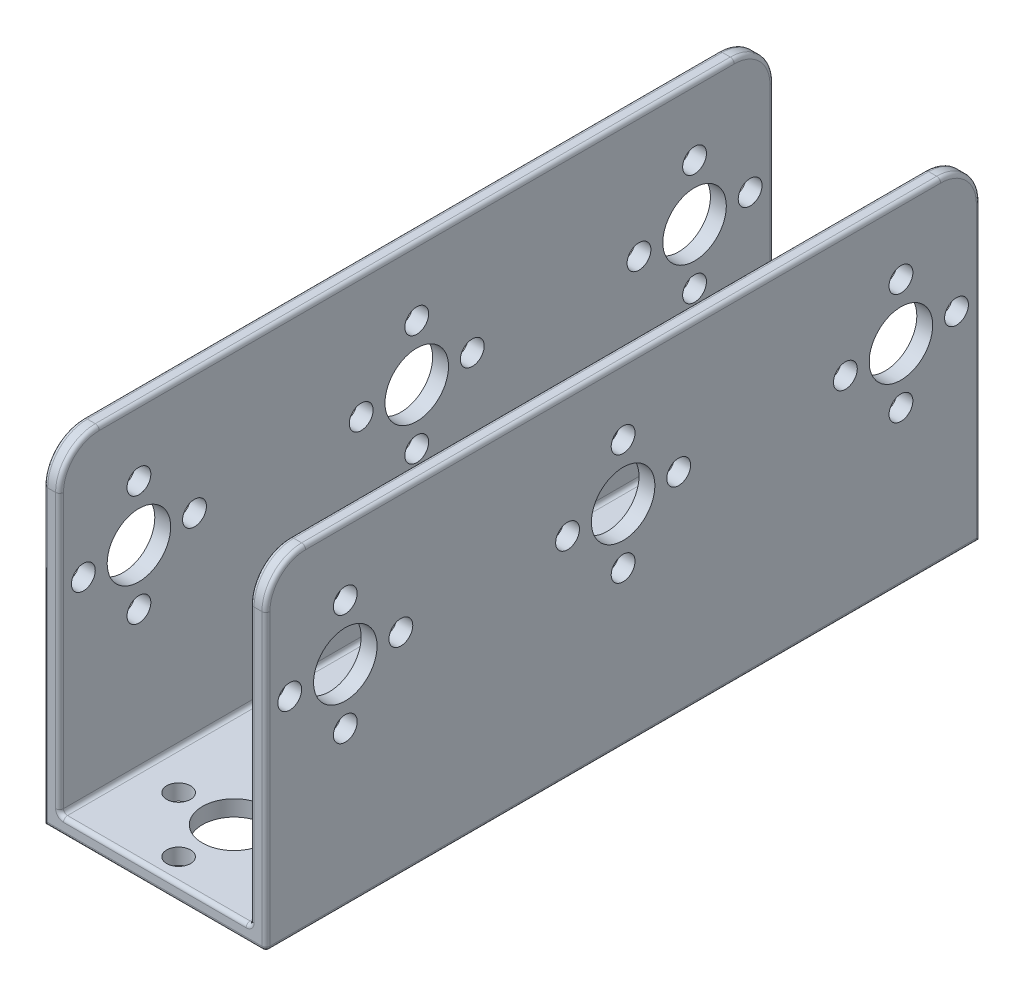
from build123d import *

# Parameters (mm, degrees)
SKETCH1_W                 = 28
SKETCH1_H                 = 90
BOSS_EXTRUDE1_DEPTH       = 2
SKETCH2_W                 = 2
SKETCH2_H                 = 90
BOSS_EXTRUDE2_DEPTH       = 40
FILLET2_R                 = 5
FILLET3_R                 = 0.5
F_8_0MM_DOWEL_HOLE1_D     = 8
F_3_0MM_DOWEL_HOLE2_D     = 3
F_8_0MM_DOWEL_HOLE2_D     = 8
F_8_0MM_DOWEL_HOLE2_DEPTH = 3
F_8_0MM_DOWEL_HOLE2_TIP   = 2.403442476
F_3_0MM_DOWEL_HOLE3_D     = 3


with BuildPart() as part:
    # Sketch1 → Boss-Extrude1 (new body)
    with BuildSketch(Plane(origin=(0, 0, 0), x_dir=(1, 0, 0), z_dir=(0, 1, 0))):
        Rectangle(SKETCH1_W, SKETCH1_H)
    extrude(amount=BOSS_EXTRUDE1_DEPTH)

    # Sketch2 → Boss-Extrude2 (add)
    with BuildSketch(Plane(origin=(0, 2, 0), x_dir=(1, 0, 0), z_dir=(0, 1, 0))):
        with Locations((13, 0)):
            Rectangle(SKETCH2_W, SKETCH2_H)
        with Locations((-13, 0)):
            Rectangle(SKETCH2_W, SKETCH2_H)
    extrude(amount=BOSS_EXTRUDE2_DEPTH)

    # Fillet2
    fillet2_edges = [part.edges().sort_by_distance(p)[0] for p in [
        (13, 42, -45),
        (13, 42, 45),
        (-13, 42, 45),
        (-13, 42, -45),
    ]]
    fillet(fillet2_edges, radius=FILLET2_R)

    # Fillet3
    fillet3_edges = [part.edges().sort_by_distance(p)[0] for p in [
        (0, 2, -45),
        (12, 2, 0),
        (0, 2, 45),
        (-12, 2, 0),
        (14, 42, 0),
        (12, 42, 0),
        (12, 19.5, 45),
        (12, 19.5, -45),
        (12, 40.535533906, 43.535533906),
        (12, 40.535533906, -43.535533906),
        (-14, 18.5, -45),
        (-12, 19.5, -45),
        (14, 18.5, -45),
        (14, 18.5, 45),
        (14, 40.535533906, 43.535533906),
        (14, 40.535533906, -43.535533906),
        (-14, 42, 0),
        (0, 0, 45),
        (-12, 42, 0),
        (-14, 18.5, 45),
        (-14, 40.535533906, 43.535533906),
        (-14, 40.535533906, -43.535533906),
        (-12, 19.5, 45),
        (-12, 40.535533906, 43.535533906),
        (-12, 40.535533906, -43.535533906),
        (14, 0, 0),
    ]]
    fillet(fillet3_edges, radius=FILLET3_R)

    # Ø8.0mm Dowel Hole1 (through all)
    with Locations(Plane(origin=(14, 0, 0), x_dir=(0, 0, -1), z_dir=(1, 0, 0))):
        with Locations((0, 26.5), (-35, 26.5), (35, 26.5)):
            Hole(F_8_0MM_DOWEL_HOLE1_D / 2)

    # Ø3.0mm Dowel Hole2 (through all)
    with Locations(Plane(origin=(14, 0, 0), x_dir=(0, 0, -1), z_dir=(1, 0, 0))):
        with Locations((-35, 33.5), (-28, 26.5), (-35, 19.5), (-42, 26.5), (-35, 26.5), (0, 33.5), (7, 26.5), (0, 19.5), (-7, 26.5), (35, 33.5), (42, 26.5), (35, 19.5), (28, 26.5), (0, 26.5), (35, 26.5)):
            Hole(F_3_0MM_DOWEL_HOLE2_D / 2)

    # Ø8.0mm Dowel Hole2
    with Locations(Plane(origin=(0, 0, 0), x_dir=(-1, 0, 0), z_dir=(0, -1, 0))):
        with Locations((0, 0), (0, 35), (0, -35)):
            Hole(F_8_0MM_DOWEL_HOLE2_D / 2, depth=F_8_0MM_DOWEL_HOLE2_DEPTH)
            with Locations((0, 0, -(F_8_0MM_DOWEL_HOLE2_DEPTH + F_8_0MM_DOWEL_HOLE2_TIP / 2))):  # 118° drill point
                Cone(0, F_8_0MM_DOWEL_HOLE2_D / 2, F_8_0MM_DOWEL_HOLE2_TIP, mode=Mode.SUBTRACT)

    # Ø3.0mm Dowel Hole3 (through all)
    with Locations(Plane(origin=(0, 0, 0), x_dir=(-1, 0, 0), z_dir=(0, -1, 0))):
        with Locations((0, -7), (0, -35), (0, -28), (0, 35), (0, 28), (7, 0), (0, 7), (-7, 0), (0, 0), (7, -35), (0, -42), (-7, -35), (-7, 35), (0, 42), (7, 35)):
            Hole(F_3_0MM_DOWEL_HOLE3_D / 2)


solid = part.part
